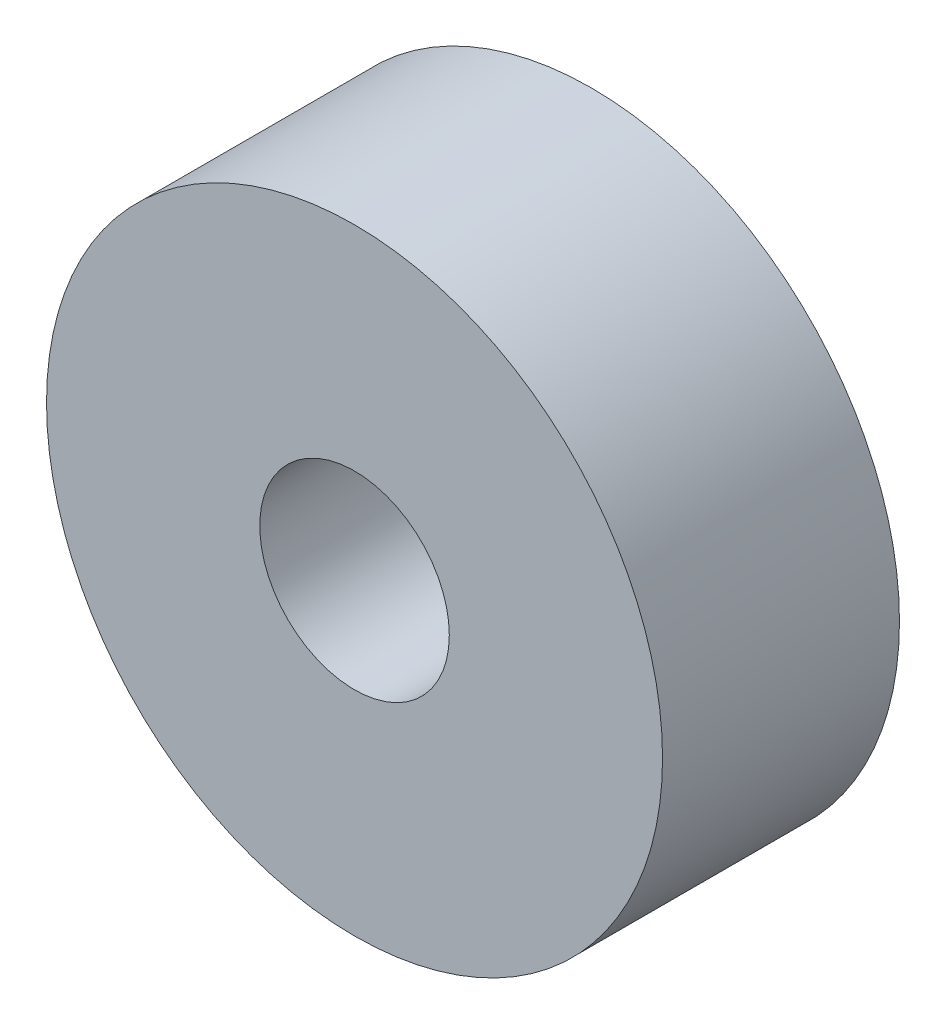
from build123d import *

# Parameters (mm, degrees)
ESQUISSE1_R        = 6.5
ESQUISSE1_R_2      = 2
BOSS_EXTRU_1_DEPTH = 5


with BuildPart() as part:
    # Esquisse1 → Boss.-Extru.1 (new body)
    with BuildSketch(Plane.XY):
        Circle(ESQUISSE1_R)
        Circle(ESQUISSE1_R_2, mode=Mode.SUBTRACT)
    extrude(amount=BOSS_EXTRU_1_DEPTH)


solid = part.part
